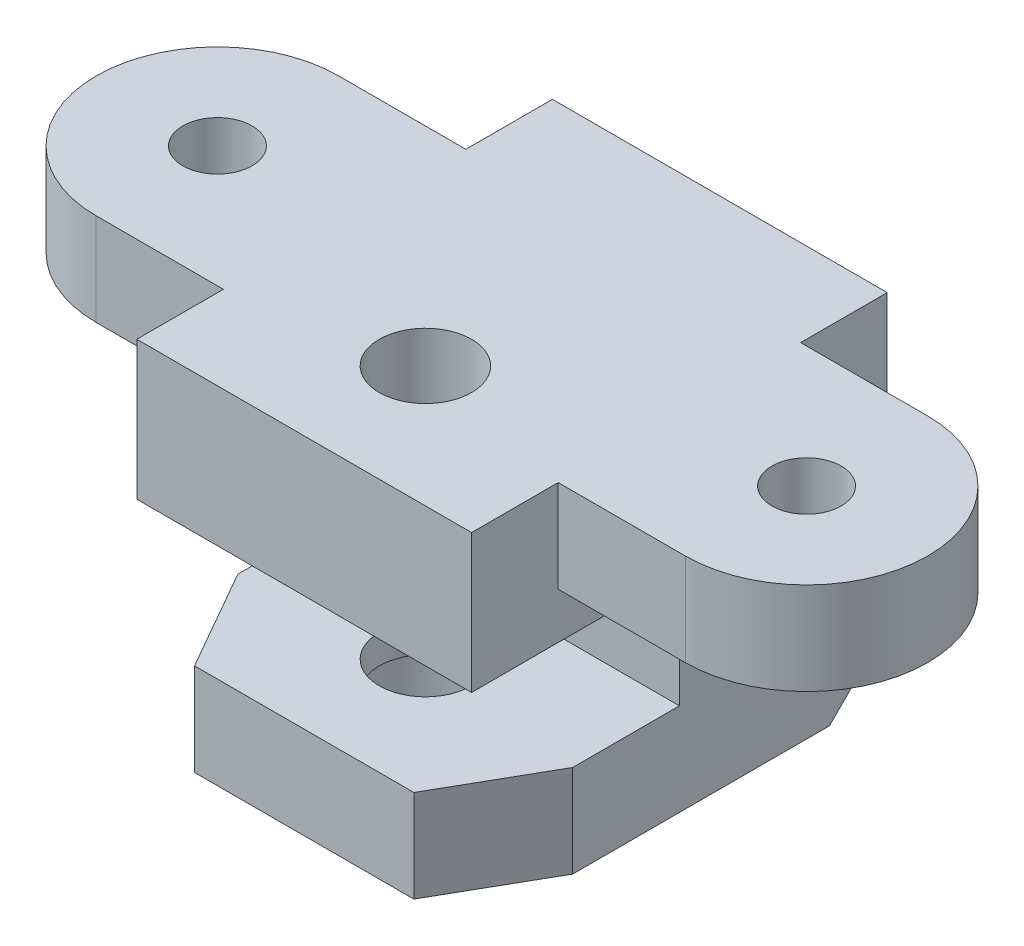
from build123d import *

# Parameters (mm, degrees)
SKETCH_1_W          = 116
SKETCH_1_H          = 144
EXTRUDE_1_DEPTH     = 120
SKETCH_2_R          = 12
EXTRUDE_3_DEPTH     = 32
SKETCH_6_W          = 72
SKETCH_6_H          = 40
CUT_EXTRUDE_1_DEPTH = 182.76908428
CUT_EXTRUDE_3_REACH = 202.848
CUT_EXTRUDE_4_REACH = 247.797
SKETCH_10_R         = 16
CUT_EXTRUDE_5_DEPTH = 201.848142751
SKETCH_11_R         = 27
CUT_EXTRUDE_6_DEPTH = 22


with BuildPart() as part:
    # 草图1 → 凸台-拉伸1 (new body)
    with BuildSketch(Plane(origin=(0, 0, 0), x_dir=(1, 0, 0), z_dir=(0, 1, 0))):
        Rectangle(SKETCH_1_W, SKETCH_1_H)
    extrude(amount=-EXTRUDE_1_DEPTH)

    # 草图2 → 凸台-拉伸3 (add)
    with BuildSketch(Plane(origin=(0, 0, 0), x_dir=(1, 0, 0), z_dir=(0, 1, 0))):
        with BuildLine():
            Line((-58, 42), (-102.069345964, 42))
            ThreePointArc((-102.069345964, 42), (-144.069345964, 0), (-102.069345964, -42))
            Line((-102.069345964, -42), (-58, -42))
            Line((-58, -42), (-58, 42))
        make_face()
        with Locations(Location((-102.069345964, 0, 0), (0, 0, 270))):
            Circle(SKETCH_2_R, mode=Mode.SUBTRACT)
    extrude_3 = extrude(amount=-EXTRUDE_3_DEPTH)

    # 草图6 → 切除-拉伸1 (cut, through all)
    with BuildSketch(Plane.ZY.offset(58)):
        with Locations((36, -68)):
            Rectangle(SKETCH_6_W, SKETCH_6_H)
    extrude(amount=-CUT_EXTRUDE_1_DEPTH, mode=Mode.SUBTRACT)

    # 草图8 → 切除-拉伸3 (cut, up to next)
    with BuildSketch(Plane.XZ.offset(120), mode=Mode.PRIVATE) as cut_extrude_3_sk1:
        Polygon((-38, 72), (-58, 37), (-58, 72), align=None)
    cut_extrude_3_tool1 = extrude(cut_extrude_3_sk1.sketch, amount=-CUT_EXTRUDE_3_REACH, mode=Mode.PRIVATE) & part.part
    cut_extrude_3 = cut_extrude_3_tool1.solids().sort_by_distance((-51.333333, -120, 60.333333))[0]
    add(cut_extrude_3, mode=Mode.SUBTRACT)

    # 镜向1: 凸台-拉伸3, 切除-拉伸3 across plane
    add(extrude_3.mirror(Plane(origin=(0, 0, 0), x_dir=(0, 0, 1), z_dir=(1, 0, 0))))
    add(cut_extrude_3.mirror(Plane(origin=(0, 0, 0), x_dir=(0, 0, 1), z_dir=(1, 0, 0))), mode=Mode.SUBTRACT)

    # 草图9 → 切除-拉伸4 (cut, up to next)
    with BuildSketch(Plane.ZY.offset(58), mode=Mode.PRIVATE) as cut_extrude_4_sk1:
        Polygon((-72, -100), (-52, -120), (-72, -120), align=None)
    cut_extrude_4_tool1 = extrude(cut_extrude_4_sk1.sketch, amount=-CUT_EXTRUDE_4_REACH, mode=Mode.PRIVATE) & part.part
    add(cut_extrude_4_tool1.solids().sort_by_distance((-58, -113.333333, -65.333333))[0], mode=Mode.SUBTRACT)

    # 草图10 → 切除-拉伸5 (cut, through all)
    with BuildSketch(Plane(origin=(0, 0, 0), x_dir=(1, 0, 0), z_dir=(0, 1, 0))):
        with Locations(Location((0, -30, 0), (0, 0, 270))):
            Circle(SKETCH_10_R)
    extrude(amount=-CUT_EXTRUDE_5_DEPTH, mode=Mode.SUBTRACT)

    # 草图11 → 切除-拉伸6 (cut)
    with BuildSketch(Plane.XZ.offset(120)):
        with Locations(Location((0, 30, 0), (0, 0, 270))):
            Circle(SKETCH_11_R)
    extrude(amount=-CUT_EXTRUDE_6_DEPTH, mode=Mode.SUBTRACT)


solid = part.part
